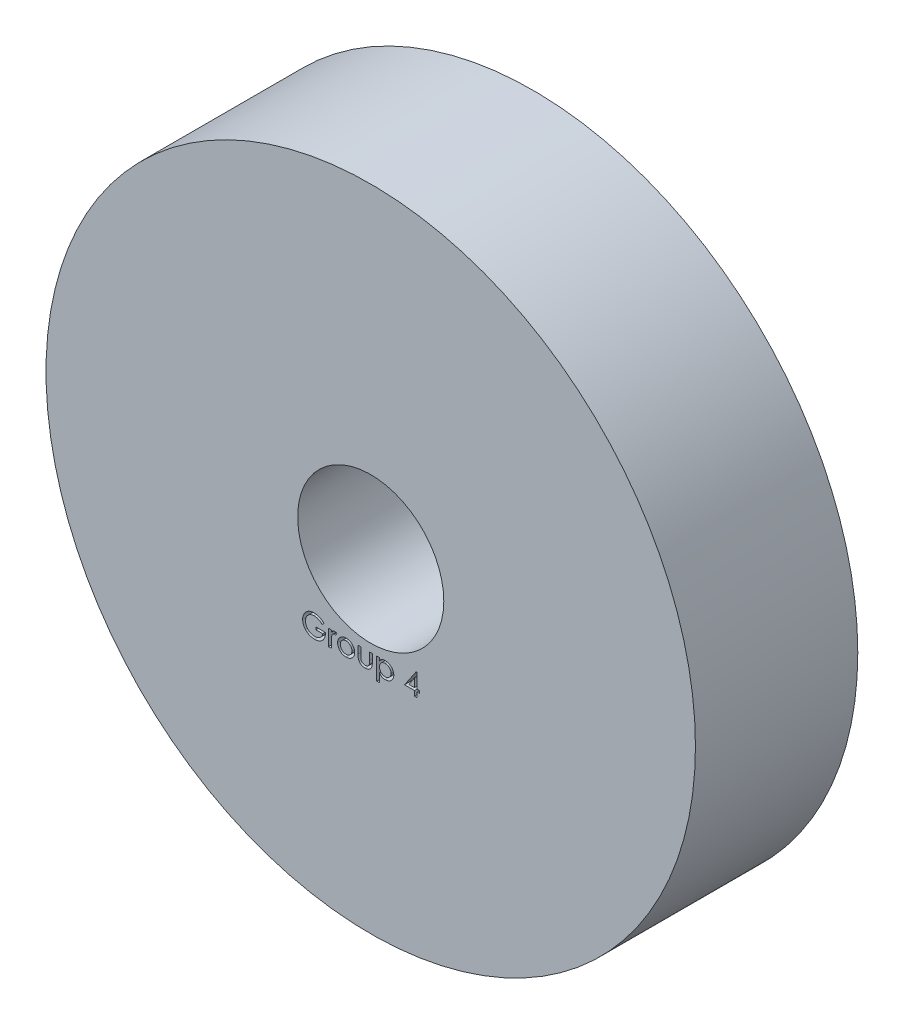
from build123d import *

# Parameters (mm, degrees)
SKETCH1_R           = 20
SKETCH1_R_2         = 4.5
BOSS_EXTRUDE1_DEPTH = 10
CUT_EXTRUDE1_DEPTH  = 1


with BuildPart() as part:
    # Sketch1 → Boss-Extrude1 (new body)
    with BuildSketch(Plane.XY):
        Circle(SKETCH1_R)
        Circle(SKETCH1_R_2, mode=Mode.SUBTRACT)
    extrude(amount=BOSS_EXTRUDE1_DEPTH)

    # Sketch2 → Cut-Extrude1 (cut)
    # profile 1 of 6: a face of its own
    with BuildSketch(Plane.XY.offset(10)):
        with BuildLine():
            Line((-2.869089197, -4.881500008), (-2.997617759, -4.993333108))
            add(Edge.make_bspline(
                [(-2.997617759, -4.993333108), (-3.017782131, -4.975725542), (-3.057036892, -4.941448215), (-3.118501553, -4.896169584), (-3.180310142, -4.857978298), (-3.242479023, -4.827330284), (-3.303958808, -4.802783233), (-3.365029647, -4.785907221), (-3.425205948, -4.774881867), (-3.465221814, -4.773519306), (-3.484966267, -4.772846997)],
                knots=[0, 0, 0, 0, 1.174203348, 2.285866929, 3.345479548, 4.357773815, 5.323690501, 6.245291137, 7.134199255, 8, 8, 8, 8], degree=3))
            add(Edge.make_bspline(
                [(-3.484966267, -4.772846997), (-3.496371107, -4.77302565), (-3.519145128, -4.773382399), (-3.553123323, -4.777050821), (-3.586770224, -4.782522952), (-3.620106317, -4.790354503), (-3.653202125, -4.800010725), (-3.685804313, -4.812324599), (-3.71811349, -4.826728574), (-3.749867797, -4.843304836), (-3.780731697, -4.861693327), (-3.810065637, -4.881930814), (-3.837686735, -4.903984435), (-3.863646752, -4.927791795), (-3.887793227, -4.953389232), (-3.910484, -4.980408496), (-3.931131384, -5.009482973), (-3.950137301, -5.039986546), (-3.966897878, -5.071702578), (-3.981983597, -5.103867861), (-3.994402634, -5.136755177), (-4.004453301, -5.170255035), (-4.012458389, -5.204323622), (-4.01826947, -5.238923408), (-4.021865498, -5.274164206), (-4.022221535, -5.297818025), (-4.022401163, -5.309751878)],
                knots=[0, 0, 0, 0, 0.9732313, 1.943419598, 2.914105962, 3.881741322, 4.864768402, 5.855028487, 6.854206409, 7.882911434, 8.911035887, 9.919250175, 10.922630637, 11.925982763, 12.923451909, 13.924676513, 14.935397504, 15.964931351, 16.990480746, 17.995899336, 18.995873688, 19.988284801, 20.979664002, 21.981342857, 22.981544644, 24, 24, 24, 24], degree=3))
            add(Edge.make_bspline(
                [(-4.022401163, -5.309751878), (-4.022097358, -5.321948461), (-4.021490792, -5.346299661), (-4.01812324, -5.382547712), (-4.011958038, -5.418129344), (-4.003394181, -5.453084665), (-3.992574516, -5.487456625), (-3.979304882, -5.521333746), (-3.963229358, -5.554376546), (-3.945401899, -5.586888621), (-3.92534044, -5.618091892), (-3.903187946, -5.647503564), (-3.879692307, -5.675503543), (-3.85414825, -5.701312346), (-3.827325732, -5.725793517), (-3.798289631, -5.747870792), (-3.767855817, -5.768629331), (-3.735821575, -5.787434435), (-3.702470427, -5.804018984), (-3.66835525, -5.81865193), (-3.633364589, -5.830885659), (-3.597714542, -5.840969321), (-3.561218098, -5.848637094), (-3.524140081, -5.854139547), (-3.486276416, -5.857803093), (-3.460770903, -5.858144388), (-3.447865239, -5.858317082)],
                knots=[0, 0, 0, 0, 0.993588149, 1.983757546, 2.962012758, 3.932297264, 4.913089422, 5.895147596, 6.892791648, 7.904042674, 8.913936126, 9.911190904, 10.901569418, 11.888649192, 12.866825019, 13.856968273, 14.856789458, 15.866221433, 16.879824684, 17.888846278, 18.887838639, 19.896937192, 20.90452114, 21.923117541, 22.949107649, 24, 24, 24, 24], degree=3))
            add(Edge.make_bspline(
                [(-3.447865239, -5.858317082), (-3.431772092, -5.857954917), (-3.400027754, -5.857240534), (-3.353431877, -5.851770245), (-3.308624544, -5.843323993), (-3.266062304, -5.830196578), (-3.225066484, -5.814582644), (-3.186248651, -5.794692135), (-3.149144007, -5.771629853), (-3.114549865, -5.744872184), (-3.08231011, -5.716052458), (-3.053599418, -5.685026296), (-3.027923509, -5.652800331), (-3.006275854, -5.618600639), (-2.98748522, -5.583385765), (-2.972600543, -5.54641326), (-2.961062623, -5.507997309), (-2.956290946, -5.481533421), (-2.953891547, -5.46822627)],
                knots=[0, 0, 0, 0, 1.125101743, 2.219305524, 3.276925285, 4.308813505, 5.329771737, 6.340890082, 7.353855978, 8.380572537, 9.395307413, 10.374367262, 11.333343716, 12.272376171, 13.200803521, 14.12078735, 15.055053215, 16, 16, 16, 16], degree=3))
            Line((-2.953891547, -5.46822627), (-3.3779033, -5.46822627))
            Line((-3.3779033, -5.46822627), (-3.3779033, -5.315582039))
            Line((-3.3779033, -5.315582039), (-2.784286847, -5.315582039))
            add(Edge.make_bspline(
                [(-2.784286847, -5.315582039), (-2.784888016, -5.341759858), (-2.786061565, -5.392861899), (-2.79548296, -5.467351635), (-2.809374348, -5.537792357), (-2.829669433, -5.603886919), (-2.855384616, -5.665728471), (-2.886791716, -5.723318482), (-2.923829032, -5.776640171), (-2.966246728, -5.825392861), (-3.01340495, -5.869123387), (-3.064803555, -5.907419917), (-3.120672976, -5.939204896), (-3.180299641, -5.965610598), (-3.244013673, -5.986013112), (-3.311651022, -6.000464046), (-3.383317346, -6.009403778), (-3.432467995, -6.010433376), (-3.45767051, -6.010961313)],
                knots=[0, 0, 0, 0, 1.147910205, 2.240849596, 3.288798376, 4.293882934, 5.268269983, 6.221997348, 7.165762291, 8.110600512, 9.051082397, 9.981847279, 10.915696266, 11.864665164, 12.837641225, 13.844673414, 14.894833504, 16, 16, 16, 16], degree=3))
            add(Edge.make_bspline(
                [(-3.45767051, -6.010961313), (-3.472515993, -6.010744344), (-3.50188194, -6.010315157), (-3.545295634, -6.007307903), (-3.587597063, -6.002660794), (-3.628611356, -5.995684663), (-3.66856003, -5.987053872), (-3.707117773, -5.976015826), (-3.744809247, -5.963784727), (-3.78096758, -5.94866468), (-3.816362966, -5.932439951), (-3.850408417, -5.913767457), (-3.883135168, -5.89296929), (-3.915235941, -5.870868559), (-3.945477051, -5.846068875), (-3.974872789, -5.819755305), (-4.002970225, -5.791394113), (-4.0206486, -5.771223123), (-4.029556361, -5.761059387)],
                knots=[0, 0, 0, 0, 1.103516608, 2.18287355, 3.233646581, 4.265703846, 5.274262808, 6.270085734, 7.246073526, 8.217965859, 9.181570311, 10.139587173, 11.101556858, 12.063436887, 13.034641265, 14.006444858, 14.995489556, 16, 16, 16, 16], degree=3))
            add(Edge.make_bspline(
                [(-4.029556361, -5.761059387), (-4.042611264, -5.744961296), (-4.068440621, -5.713110937), (-4.100986938, -5.661519398), (-4.12956017, -5.608710279), (-4.152275425, -5.553574253), (-4.170121487, -5.496649176), (-4.182920417, -5.437778739), (-4.190366152, -5.376990661), (-4.191455779, -5.335830961), (-4.192005864, -5.315052025)],
                knots=[0, 0, 0, 0, 1.024988564, 2.027958144, 3.013741914, 3.99376912, 4.974186348, 5.962951834, 6.97162285, 8, 8, 8, 8], degree=3))
            add(Edge.make_bspline(
                [(-4.192005864, -5.315052025), (-4.191807711, -5.299491991), (-4.191415044, -5.268657628), (-4.18654441, -5.222839035), (-4.179560056, -5.177756499), (-4.169468956, -5.133481228), (-4.15643304, -5.090103495), (-4.140408656, -5.04756101), (-4.121702372, -5.005705192), (-4.099844665, -4.965046443), (-4.076055717, -4.925593585), (-4.049320432, -4.888572259), (-4.021009115, -4.853285564), (-3.990130626, -4.82058062), (-3.957570984, -4.789547431), (-3.922386382, -4.761277239), (-3.885306051, -4.734930135), (-3.846011447, -4.711138302), (-3.805143658, -4.689758181), (-3.762789345, -4.671006959), (-3.719031238, -4.655575941), (-3.67417417, -4.642330391), (-3.627870433, -4.632697273), (-3.580361665, -4.625584022), (-3.531528297, -4.620800484), (-3.498493025, -4.620403521), (-3.481786179, -4.620202766)],
                knots=[0, 0, 0, 0, 1.010042427, 2.001538926, 2.988977894, 3.97147212, 4.947868168, 5.928132478, 6.921817128, 7.922678872, 8.924230854, 9.911186466, 10.885946514, 11.860014231, 12.829900618, 13.804660667, 14.788293046, 15.781961137, 16.785220236, 17.781814947, 18.787040195, 19.796447094, 20.816926666, 21.855387176, 22.915410262, 24, 24, 24, 24], degree=3))
            add(Edge.make_bspline(
                [(-3.481786179, -4.620202766), (-3.467737465, -4.620452007), (-3.439793038, -4.620947774), (-3.398212176, -4.623527753), (-3.357246217, -4.628275952), (-3.31698547, -4.635355615), (-3.277189442, -4.643612491), (-3.238225248, -4.654330361), (-3.199941231, -4.666821763), (-3.162149378, -4.681170834), (-3.124693489, -4.697623938), (-3.08746848, -4.716440806), (-3.050633288, -4.738090536), (-3.013799469, -4.761891454), (-2.977197671, -4.788175871), (-2.940886152, -4.816959756), (-2.904424704, -4.847843791), (-2.880993881, -4.870161084), (-2.869089197, -4.881500008)],
                knots=[0, 0, 0, 0, 0.985310127, 1.959889608, 2.920407961, 3.875718043, 4.825872088, 5.769643135, 6.708031182, 7.649175746, 8.603380435, 9.575831151, 10.572468945, 11.59831001, 12.650450436, 13.731164539, 14.847254788, 16, 16, 16, 16], degree=3))
        make_face()
    # profile 2 of 6: a face of its own
    with BuildSketch(Plane.XY.offset(10)):
        with BuildLine():
            Line((-2.597721676, -4.993333108), (-2.428116975, -4.993333108))
            Line((-2.428116975, -4.993333108), (-2.428116975, -5.132991979))
            add(Edge.make_bspline(
                [(-2.428116975, -5.132991979), (-2.427093578, -5.126606789), (-2.425096053, -5.114143805), (-2.420057405, -5.096233909), (-2.413088305, -5.079605974), (-2.404328592, -5.064241081), (-2.393940154, -5.050080871), (-2.381817563, -5.037213804), (-2.368017213, -5.02545965), (-2.347138458, -5.01202482), (-2.319726018, -4.997815006), (-2.285330757, -4.985483037), (-2.250119145, -4.977670698), (-2.226221103, -4.976805711), (-2.214256047, -4.976372638)],
                knots=[0, 0, 0, 0, 0.801625561, 1.56465941, 2.301277113, 3.032414989, 3.753384473, 4.4742707, 5.220602463, 5.995500889, 7.548895402, 9.039144265, 10.517585467, 12, 12, 12, 12], degree=3))
            add(Edge.make_bspline(
                [(-2.214256047, -4.976372638), (-2.203434213, -4.977015277), (-2.180698876, -4.978365384), (-2.145776357, -4.987367015), (-2.109003136, -5.002223697), (-2.084713824, -5.015503769), (-2.071947103, -5.022483916)],
                knots=[0, 0, 0, 0, 0.858860638, 1.804360244, 2.845948385, 4, 4, 4, 4], degree=3))
            Line((-2.071947103, -5.022483916), (-2.152244329, -5.145712331))
            add(Edge.make_bspline(
                [(-2.152244329, -5.145712331), (-2.161403578, -5.143121357), (-2.17813582, -5.138388131), (-2.201199658, -5.133566181), (-2.219447812, -5.129911677), (-2.230145852, -5.129282466), (-2.234661613, -5.129016869)],
                knots=[0, 0, 0, 0, 1.354987806, 2.475310119, 3.356411532, 4, 4, 4, 4], degree=3))
            add(Edge.make_bspline(
                [(-2.234661613, -5.129016869), (-2.242061028, -5.129559482), (-2.257635005, -5.130701551), (-2.280867004, -5.139677844), (-2.304719874, -5.153526855), (-2.324371556, -5.169033758), (-2.340136962, -5.184190882), (-2.351416276, -5.198094321), (-2.362363296, -5.213829523), (-2.372640065, -5.231555831), (-2.382124172, -5.251288148), (-2.391093536, -5.272798885), (-2.399709388, -5.296169311), (-2.404459778, -5.312633125), (-2.406916387, -5.321147194)],
                knots=[0, 0, 0, 0, 0.965356871, 2.031842204, 3.216327082, 4.56533618, 5.292082419, 6.07124699, 6.900886396, 7.796081313, 8.746333432, 9.760722644, 10.841983902, 12, 12, 12, 12], degree=3))
            add(Edge.make_bspline(
                [(-2.406916387, -5.321147194), (-2.408710144, -5.32819052), (-2.412734705, -5.343993277), (-2.416523667, -5.370820028), (-2.420338516, -5.402875937), (-2.423022063, -5.440289223), (-2.425495391, -5.482953061), (-2.426902243, -5.53102622), (-2.428068867, -5.584470375), (-2.428100443, -5.621929683), (-2.428116975, -5.641541074)],
                knots=[0, 0, 0, 0, 0.541796663, 1.215601946, 2.018210726, 2.950106988, 4.012619945, 5.205915212, 6.537188929, 8, 8, 8, 8], degree=3))
            Line((-2.428116975, -5.641541074), (-2.428116975, -5.977040373))
            Line((-2.428116975, -5.977040373), (-2.597721676, -5.977040373))
            Line((-2.597721676, -5.977040373), (-2.597721676, -4.993333108))
        make_face()
    # profile 3 of 6: a face of its own
    with BuildSketch(Plane.XY.offset(10)):
        with BuildLine():
            add(Edge.make_bspline(
                [(-1.52020181, -4.976372638), (-1.500569749, -4.976910259), (-1.462133877, -4.977962821), (-1.405892063, -4.985368089), (-1.352484749, -4.998234493), (-1.301758864, -5.015844514), (-1.253923172, -5.038916097), (-1.208858196, -5.066828729), (-1.166725054, -5.100125158), (-1.141345626, -5.125655967), (-1.128520954, -5.138557133)],
                knots=[0, 0, 0, 0, 1.078775739, 2.112039281, 3.110494877, 4.093081892, 5.057110616, 6.022958758, 7.000966324, 8, 8, 8, 8], degree=3))
            add(Edge.make_bspline(
                [(-1.128520954, -5.138557133), (-1.117148081, -5.151344473), (-1.094788125, -5.176485381), (-1.065896641, -5.217038859), (-1.041291998, -5.258755799), (-1.021386181, -5.301950706), (-1.005519807, -5.346426058), (-0.994516362, -5.392357592), (-0.987587223, -5.439658415), (-0.986850085, -5.471647189), (-0.986477017, -5.487836814)],
                knots=[0, 0, 0, 0, 1.062178036, 2.088324843, 3.086640365, 4.066023852, 5.037709567, 6.014384934, 6.995073642, 8, 8, 8, 8], degree=3))
            add(Edge.make_bspline(
                [(-0.986477017, -5.487836814), (-0.986943298, -5.504115771), (-0.987867402, -5.536378403), (-0.995020494, -5.584037187), (-1.00633324, -5.630426528), (-1.022606935, -5.675334646), (-1.0435508, -5.718810267), (-1.068677055, -5.76111785), (-1.098971253, -5.801694292), (-1.133032541, -5.840657241), (-1.170884276, -5.876602232), (-1.212193067, -5.908071729), (-1.256452504, -5.934703298), (-1.303582666, -5.956624755), (-1.353808325, -5.973189348), (-1.406642933, -5.985456463), (-1.462494109, -5.992700987), (-1.500658232, -5.993560627), (-1.52020181, -5.994000843)],
                knots=[0, 0, 0, 0, 0.952871876, 1.888459614, 2.815544184, 3.744891397, 4.679563604, 5.637601804, 6.621431805, 7.640342292, 8.664856555, 9.672479278, 10.67487095, 11.683873433, 12.709444777, 13.765907845, 14.855937143, 16, 16, 16, 16], degree=3))
            add(Edge.make_bspline(
                [(-1.52020181, -5.994000843), (-1.538866796, -5.993572145), (-1.575455573, -5.992731774), (-1.628922966, -5.985271111), (-1.679908062, -5.973885299), (-1.728039042, -5.956946541), (-1.773712406, -5.935764292), (-1.81662262, -5.909491924), (-1.857100197, -5.878754477), (-1.894089238, -5.843191097), (-1.927803676, -5.804959189), (-1.957067269, -5.764370945), (-1.982236717, -5.722370003), (-2.002699115, -5.678601097), (-2.018379745, -5.633079964), (-2.029860987, -5.586182264), (-2.036565559, -5.537497788), (-2.037534527, -5.504552586), (-2.038026163, -5.487836814)],
                knots=[0, 0, 0, 0, 1.108842573, 2.173652473, 3.202745058, 4.208988794, 5.200203338, 6.189803525, 7.193715926, 8.215010613, 9.234454675, 10.219573757, 11.184848795, 12.140854958, 13.08565054, 14.042002664, 15.006549187, 16, 16, 16, 16], degree=3))
            add(Edge.make_bspline(
                [(-2.038026163, -5.487836814), (-2.037625749, -5.471298624), (-2.036836854, -5.438715116), (-2.030370021, -5.39067156), (-2.019397809, -5.344508737), (-2.004606486, -5.299853058), (-1.985074632, -5.257044539), (-1.961328926, -5.215841623), (-1.933584105, -5.17609218), (-1.911956619, -5.151693226), (-1.901017365, -5.139352155)],
                knots=[0, 0, 0, 0, 1.034079547, 2.037341334, 3.024980457, 3.998111168, 4.974764182, 5.962233312, 6.969290918, 8, 8, 8, 8], degree=3))
            add(Edge.make_bspline(
                [(-1.901017365, -5.139352155), (-1.888291275, -5.126352147), (-1.863202518, -5.100723378), (-1.821442587, -5.067495722), (-1.77738369, -5.039164707), (-1.730582568, -5.01638353), (-1.681585419, -4.998079464), (-1.629910828, -4.98546438), (-1.575809197, -4.977964964), (-1.538952999, -4.976909581), (-1.52020181, -4.976372638)],
                knots=[0, 0, 0, 0, 1.021997278, 2.014808882, 2.992991082, 3.961403697, 4.935644248, 5.92819495, 6.945935601, 8, 8, 8, 8], degree=3))
        make_face()
        with BuildLine():
            add(Edge.make_bspline(
                [(-1.520731825, -5.129016869), (-1.532055741, -5.129318617), (-1.554539982, -5.129917754), (-1.587657427, -5.134820449), (-1.619846116, -5.142748557), (-1.650752831, -5.154258822), (-1.680844081, -5.16864318), (-1.709614149, -5.18655949), (-1.737711433, -5.207280631), (-1.764113057, -5.231275154), (-1.788677133, -5.257396699), (-1.809959919, -5.285724645), (-1.828166747, -5.315464738), (-1.842747754, -5.346992372), (-1.854268457, -5.380093528), (-1.862329664, -5.414831805), (-1.867642846, -5.451190856), (-1.868158366, -5.475980467), (-1.868421462, -5.488631836)],
                knots=[0, 0, 0, 0, 0.976916649, 1.939720157, 2.882730922, 3.833047911, 4.780976627, 5.756404754, 6.753607, 7.790049989, 8.831165002, 9.84360893, 10.842529111, 11.835057585, 12.835634664, 13.861933882, 14.908838789, 16, 16, 16, 16], degree=3))
            add(Edge.make_bspline(
                [(-1.868421462, -5.488631836), (-1.867819072, -5.505109005), (-1.866633553, -5.537536512), (-1.856946145, -5.585034572), (-1.84157171, -5.630428495), (-1.820105812, -5.673125963), (-1.793864415, -5.712189173), (-1.763275969, -5.746386881), (-1.729510048, -5.775991304), (-1.691914756, -5.799764779), (-1.65177909, -5.818372042), (-1.609646257, -5.831618689), (-1.565753839, -5.839897589), (-1.535873848, -5.840865906), (-1.520731825, -5.841356612)],
                knots=[0, 0, 0, 0, 1.073737222, 2.11314337, 3.147909503, 4.191315005, 5.220292011, 6.207728104, 7.175628903, 8.139268678, 9.098074859, 10.052770626, 11.013219503, 12, 12, 12, 12], degree=3))
            add(Edge.make_bspline(
                [(-1.520731825, -5.841356612), (-1.504351734, -5.840796944), (-1.472073897, -5.83969409), (-1.424798571, -5.830928737), (-1.379650738, -5.816854956), (-1.336946756, -5.797240212), (-1.297315226, -5.772391014), (-1.261876318, -5.742232654), (-1.230817164, -5.707265106), (-1.204222697, -5.668288366), (-1.182746526, -5.625998403), (-1.167327795, -5.5816152), (-1.157975502, -5.535573643), (-1.156717801, -5.50439861), (-1.156081718, -5.488631836)],
                knots=[0, 0, 0, 0, 1.042880454, 2.055051067, 3.051726387, 4.048830532, 5.040201766, 6.022282375, 7.002717173, 8.011000956, 9.020163719, 10.014978664, 10.996075346, 12, 12, 12, 12], degree=3))
            add(Edge.make_bspline(
                [(-1.156081718, -5.488631836), (-1.156358104, -5.476423514), (-1.156903311, -5.452340963), (-1.16210703, -5.416908873), (-1.170552566, -5.382790698), (-1.18255384, -5.350138819), (-1.197751627, -5.31883965), (-1.21645063, -5.289026622), (-1.238584603, -5.260557625), (-1.26381685, -5.233893424), (-1.291168809, -5.20937688), (-1.320069706, -5.187725928), (-1.350460232, -5.169744047), (-1.381919169, -5.154590542), (-1.414890276, -5.143330147), (-1.449034709, -5.135080622), (-1.484439674, -5.129827652), (-1.508523073, -5.129289618), (-1.520731825, -5.129016869)],
                knots=[0, 0, 0, 0, 1.02928639, 2.030405262, 3.013559112, 3.98951401, 4.959304921, 5.943474834, 6.952548865, 7.996299005, 9.035918103, 10.047849461, 11.03697177, 12.01024899, 12.98822153, 13.969594738, 14.97071361, 16, 16, 16, 16], degree=3))
        make_face(mode=Mode.SUBTRACT)
    # profile 4 of 6: a face of its own
    with BuildSketch(Plane.XY.offset(10)):
        with BuildLine():
            Line((-0.782951376, -4.993333108), (-0.613346676, -4.993333108))
            Line((-0.613346676, -4.993333108), (-0.613346676, -5.449940763))
            add(Edge.make_bspline(
                [(-0.613346676, -5.449940763), (-0.613296897, -5.462838002), (-0.61320142, -5.487575122), (-0.612453245, -5.523094776), (-0.611025441, -5.555242317), (-0.609698566, -5.584079045), (-0.607111742, -5.609497086), (-0.604750999, -5.631744675), (-0.601315941, -5.650575241), (-0.598469403, -5.661870302), (-0.597181228, -5.666981779)],
                knots=[0, 0, 0, 0, 1.418944939, 2.721560048, 3.90822129, 4.959445687, 5.896519748, 6.718644391, 7.420134194, 8, 8, 8, 8], degree=3))
            add(Edge.make_bspline(
                [(-0.597181228, -5.666981779), (-0.592338407, -5.680701138), (-0.582977527, -5.707219832), (-0.561664418, -5.742870222), (-0.535939155, -5.773552113), (-0.504920852, -5.79828747), (-0.470321598, -5.817884549), (-0.432186995, -5.831076249), (-0.391429415, -5.840145605), (-0.363144035, -5.840945459), (-0.348604338, -5.841356612)],
                knots=[0, 0, 0, 0, 1.064698082, 2.057997224, 3.027713519, 3.985869738, 4.951769774, 5.929245647, 6.93555818, 8, 8, 8, 8], degree=3))
            add(Edge.make_bspline(
                [(-0.348604338, -5.841356612), (-0.332750599, -5.840820333), (-0.30212559, -5.839784392), (-0.258087799, -5.831154295), (-0.217789357, -5.816960422), (-0.181961689, -5.796466631), (-0.15021383, -5.772091017), (-0.124147242, -5.743207196), (-0.102342611, -5.711459156), (-0.093049944, -5.687699922), (-0.088367125, -5.675727021)],
                knots=[0, 0, 0, 0, 1.152522955, 2.226353534, 3.250900004, 4.246517978, 5.217118907, 6.149589309, 7.067529598, 8, 8, 8, 8], degree=3))
            add(Edge.make_bspline(
                [(-0.088367125, -5.675727021), (-0.086848815, -5.670716626), (-0.083479382, -5.659597558), (-0.080471839, -5.640609097), (-0.07707093, -5.618127214), (-0.075009012, -5.591731918), (-0.072695901, -5.561629703), (-0.071573149, -5.527682603), (-0.07073412, -5.49004982), (-0.070653718, -5.463721857), (-0.070611633, -5.449940763)],
                knots=[0, 0, 0, 0, 0.552623276, 1.226381414, 2.027670893, 2.955584593, 4.022320098, 5.218031084, 6.543807858, 8, 8, 8, 8], degree=3))
            Line((-0.070611633, -5.449940763), (-0.070611633, -4.993333108))
            Line((-0.070611633, -4.993333108), (0.098993068, -4.993333108))
            Line((0.098993068, -4.993333108), (0.098993068, -5.472996402))
            add(Edge.make_bspline(
                [(0.098993068, -5.472996402), (0.098819184, -5.488721687), (0.098481022, -5.519303522), (0.096488235, -5.563695513), (0.092642212, -5.60522035), (0.087975662, -5.64386583), (0.080768019, -5.679496238), (0.073163861, -5.712363654), (0.063544376, -5.742301381), (0.052357613, -5.769586699), (0.039524741, -5.79472216), (0.025041598, -5.818200866), (0.009110737, -5.840588045), (-0.008541193, -5.861747505), (-0.028131121, -5.881397381), (-0.049040382, -5.900098986), (-0.071909215, -5.917240504), (-0.096285114, -5.933182709), (-0.122337558, -5.947623982), (-0.150156799, -5.959914715), (-0.179396719, -5.970695644), (-0.210406915, -5.979003938), (-0.242918688, -5.986013838), (-0.277112882, -5.990700907), (-0.312876237, -5.993289954), (-0.337204855, -5.993760077), (-0.349664367, -5.994000843)],
                knots=[0, 0, 0, 0, 1.433126784, 2.78708125, 4.047948649, 5.23317835, 6.332013834, 7.359028814, 8.306074614, 9.194073739, 10.043734443, 10.874888521, 11.705886645, 12.545920784, 13.382708552, 14.23240739, 15.100217466, 15.98441358, 16.885165303, 17.811245298, 18.753488952, 19.72218431, 20.734230158, 21.782757764, 22.864474903, 24, 24, 24, 24], degree=3))
            add(Edge.make_bspline(
                [(-0.349664367, -5.994000843), (-0.361420707, -5.993905658), (-0.384442191, -5.993719265), (-0.418131784, -5.990575519), (-0.450448888, -5.986174838), (-0.481362132, -5.979861486), (-0.510868419, -5.971671921), (-0.538852797, -5.961545839), (-0.565440539, -5.949607022), (-0.59059261, -5.935848144), (-0.614172038, -5.920419818), (-0.636332369, -5.903720422), (-0.656737439, -5.885384324), (-0.675572913, -5.8656241), (-0.693261382, -5.84479206), (-0.70876908, -5.822033198), (-0.723159392, -5.798216797), (-0.736102756, -5.772697571), (-0.747352177, -5.744799377), (-0.756728755, -5.713891288), (-0.764954875, -5.680017682), (-0.771462754, -5.64291177), (-0.776750979, -5.60277702), (-0.780408131, -5.559358109), (-0.782452641, -5.512855858), (-0.782781855, -5.48077198), (-0.782951376, -5.46425116)],
                knots=[0, 0, 0, 0, 1.07579807, 2.106647768, 3.094742466, 4.060581056, 4.992547774, 5.895540969, 6.78231141, 7.658099749, 8.517151737, 9.359794672, 10.195893314, 11.025198922, 11.857652707, 12.69437682, 13.543128465, 14.403853537, 15.310857085, 16.293043939, 17.358059167, 18.500139289, 19.739904812, 21.062881797, 22.487601799, 24, 24, 24, 24], degree=3))
            Line((-0.782951376, -5.46425116), (-0.782951376, -4.993333108))
        make_face()
    # profile 5 of 6: a face of its own
    with BuildSketch(Plane.XY.offset(10)):
        with BuildLine():
            Line((0.370360589, -4.993333108), (0.53996529, -4.993333108))
            Line((0.53996529, -4.993333108), (0.53996529, -5.16876797))
            add(Edge.make_bspline(
                [(0.53996529, -5.16876797), (0.542509357, -5.160917479), (0.547541193, -5.14539022), (0.558449406, -5.123575251), (0.57109923, -5.103066476), (0.586071294, -5.084164949), (0.603136042, -5.066733703), (0.622700485, -5.051184325), (0.644212794, -5.036685517), (0.676241415, -5.020008508), (0.718975137, -5.002216098), (0.773366155, -4.987210665), (0.830445738, -4.977907902), (0.869421723, -4.976890228), (0.889244971, -4.976372638)],
                knots=[0, 0, 0, 0, 0.694622356, 1.37387354, 2.049401652, 2.722628407, 3.401757179, 4.100556256, 4.825325589, 5.584715007, 7.140148756, 8.717099778, 10.330311678, 12, 12, 12, 12], degree=3))
            add(Edge.make_bspline(
                [(0.889244971, -4.976372638), (0.907555441, -4.976813767), (0.94370082, -4.97768457), (0.99665043, -4.985080434), (1.047584314, -4.996619832), (1.096098587, -5.013435319), (1.14260592, -5.034817455), (1.186971046, -5.060711168), (1.228813861, -5.091923458), (1.268169435, -5.126988044), (1.303853363, -5.165507387), (1.335675943, -5.205706512), (1.362266622, -5.247872289), (1.384338935, -5.291519531), (1.40084982, -5.337077617), (1.413312472, -5.384023574), (1.42054877, -5.432754426), (1.421452671, -5.46581791), (1.421909735, -5.482536667)],
                knots=[0, 0, 0, 0, 1.076228782, 2.124505721, 3.137534021, 4.142835799, 5.137588531, 6.143359867, 7.157306602, 8.202064418, 9.238473371, 10.241181928, 11.212440163, 12.164848115, 13.111430887, 14.056330489, 15.017171362, 16, 16, 16, 16], degree=3))
            add(Edge.make_bspline(
                [(1.421909735, -5.482536667), (1.421462302, -5.499610997), (1.420577325, -5.533382258), (1.413202685, -5.583105034), (1.401322541, -5.631074115), (1.384456697, -5.677232107), (1.362927529, -5.721654383), (1.336507257, -5.764242948), (1.305306097, -5.804938677), (1.269740126, -5.84326116), (1.230942439, -5.878547241), (1.189386228, -5.909556852), (1.145486728, -5.935633537), (1.099274479, -5.956919276), (1.050958074, -5.973802917), (1.000177024, -5.985256165), (0.947326001, -5.992708316), (0.911266437, -5.993565538), (0.892955074, -5.994000843)],
                knots=[0, 0, 0, 0, 1.000690261, 1.979261891, 2.940227073, 3.893808351, 4.855122405, 5.829614775, 6.827190625, 7.857089307, 8.891134036, 9.89799758, 10.891950105, 11.879132496, 12.876641118, 13.886749785, 14.926872999, 16, 16, 16, 16], degree=3))
            add(Edge.make_bspline(
                [(0.892955074, -5.994000843), (0.873401143, -5.99335847), (0.834877839, -5.992092928), (0.778250207, -5.982996762), (0.724293593, -5.967415024), (0.681373285, -5.950053524), (0.649626396, -5.932736006), (0.627603012, -5.91866326), (0.607726266, -5.903037473), (0.589950575, -5.886031798), (0.574138033, -5.867922395), (0.560474944, -5.848418912), (0.549103852, -5.827442308), (0.543017399, -5.812705515), (0.53996529, -5.805315613)],
                knots=[0, 0, 0, 0, 1.656042569, 3.26257835, 4.842282913, 6.405528061, 7.172280682, 7.902838742, 8.616847869, 9.310130132, 9.983752423, 10.650062733, 11.323061395, 12, 12, 12, 12], degree=3))
            Line((0.53996529, -5.805315613), (0.53996529, -6.333210245))
            Line((0.53996529, -6.333210245), (0.370360589, -6.333210245))
            Line((0.370360589, -6.333210245), (0.370360589, -4.993333108))
        make_face()
        with BuildLine():
            add(Edge.make_bspline(
                [(0.887124912, -5.129016869), (0.875445851, -5.129303481), (0.852429524, -5.129868319), (0.818567849, -5.134919506), (0.785925847, -5.142400066), (0.75448753, -5.153467354), (0.724409068, -5.167732283), (0.695596452, -5.185213231), (0.667809051, -5.205359186), (0.6418635, -5.228792187), (0.618178482, -5.254676308), (0.596881141, -5.282255973), (0.579479366, -5.312127884), (0.565093523, -5.343665929), (0.553530917, -5.376881944), (0.545738191, -5.412105248), (0.540821536, -5.44909444), (0.540254641, -5.474393705), (0.53996529, -5.487306799)],
                knots=[0, 0, 0, 0, 1.005723403, 1.982013728, 2.943867151, 3.887478966, 4.847584166, 5.806995223, 6.787400874, 7.800641986, 8.813368399, 9.807417327, 10.796880851, 11.78458637, 12.790712903, 13.821019732, 14.887818371, 16, 16, 16, 16], degree=3))
            add(Edge.make_bspline(
                [(0.53996529, -5.487306799), (0.540498822, -5.50430534), (0.541540044, -5.537479092), (0.550456385, -5.585747995), (0.565384626, -5.630811094), (0.585840934, -5.672663456), (0.61157215, -5.710654023), (0.642152526, -5.744262422), (0.676809738, -5.773912192), (0.716038821, -5.797862176), (0.757588706, -5.817180428), (0.800600873, -5.830934831), (0.844432131, -5.839999331), (0.874095174, -5.840903103), (0.888979964, -5.841356612)],
                knots=[0, 0, 0, 0, 1.102029977, 2.150682694, 3.17089293, 4.172933106, 5.163105818, 6.136792055, 7.112634256, 8.111227658, 9.108587182, 10.078099529, 11.035598473, 12, 12, 12, 12], degree=3))
            add(Edge.make_bspline(
                [(0.888979964, -5.841356612), (0.904742341, -5.840801247), (0.935984049, -5.839700491), (0.98202934, -5.830715694), (1.026321567, -5.815566424), (1.068965583, -5.795362952), (1.108657108, -5.769438884), (1.14447856, -5.738333933), (1.176309005, -5.702656998), (1.202973637, -5.662403367), (1.225017916, -5.619655309), (1.24068214, -5.575161309), (1.250435667, -5.529777326), (1.251680917, -5.499191353), (1.252305034, -5.483861704)],
                knots=[0, 0, 0, 0, 1.003862332, 1.989698134, 2.97583922, 3.980411469, 4.988981437, 5.986622354, 6.995396503, 8.025784312, 9.055403073, 10.052376809, 11.023853872, 12, 12, 12, 12], degree=3))
            add(Edge.make_bspline(
                [(1.252305034, -5.483861704), (1.251687584, -5.468442815), (1.250459153, -5.43776656), (1.240707195, -5.392494181), (1.225288533, -5.34833905), (1.203530428, -5.306085348), (1.176980629, -5.266483976), (1.145898316, -5.230787622), (1.109852835, -5.200430188), (1.070171476, -5.174713593), (1.027359776, -5.154410583), (0.982331206, -5.139663138), (0.935363244, -5.130644552), (0.90332997, -5.129563668), (0.887124912, -5.129016869)],
                knots=[0, 0, 0, 0, 0.980928904, 1.951581945, 2.935231878, 3.951401631, 4.96844259, 5.964697687, 6.954166899, 7.958816287, 8.967613111, 9.961818216, 10.968920427, 12, 12, 12, 12], degree=3))
        make_face(mode=Mode.SUBTRACT)
    # profile 6 of 6: a face of its own
    with BuildSketch(Plane.XY.offset(10)):
        Polygon((2.796502834, -4.620202766), (2.863549692, -4.620202766), (2.863549692, -5.519107681), (3.016193923, -5.519107681), (3.016193923, -5.671751911), (2.863549692, -5.671751911), (2.863549692, -5.977040373), (2.693944991, -5.977040373), (2.693944991, -5.671751911), (2.083368068, -5.671751911), align=None)
        Polygon((2.693944991, -5.519107681), (2.693944991, -4.993068101), (2.357120655, -5.519107681), align=None, mode=Mode.SUBTRACT)
    extrude(amount=-CUT_EXTRUDE1_DEPTH, mode=Mode.SUBTRACT)


solid = part.part
